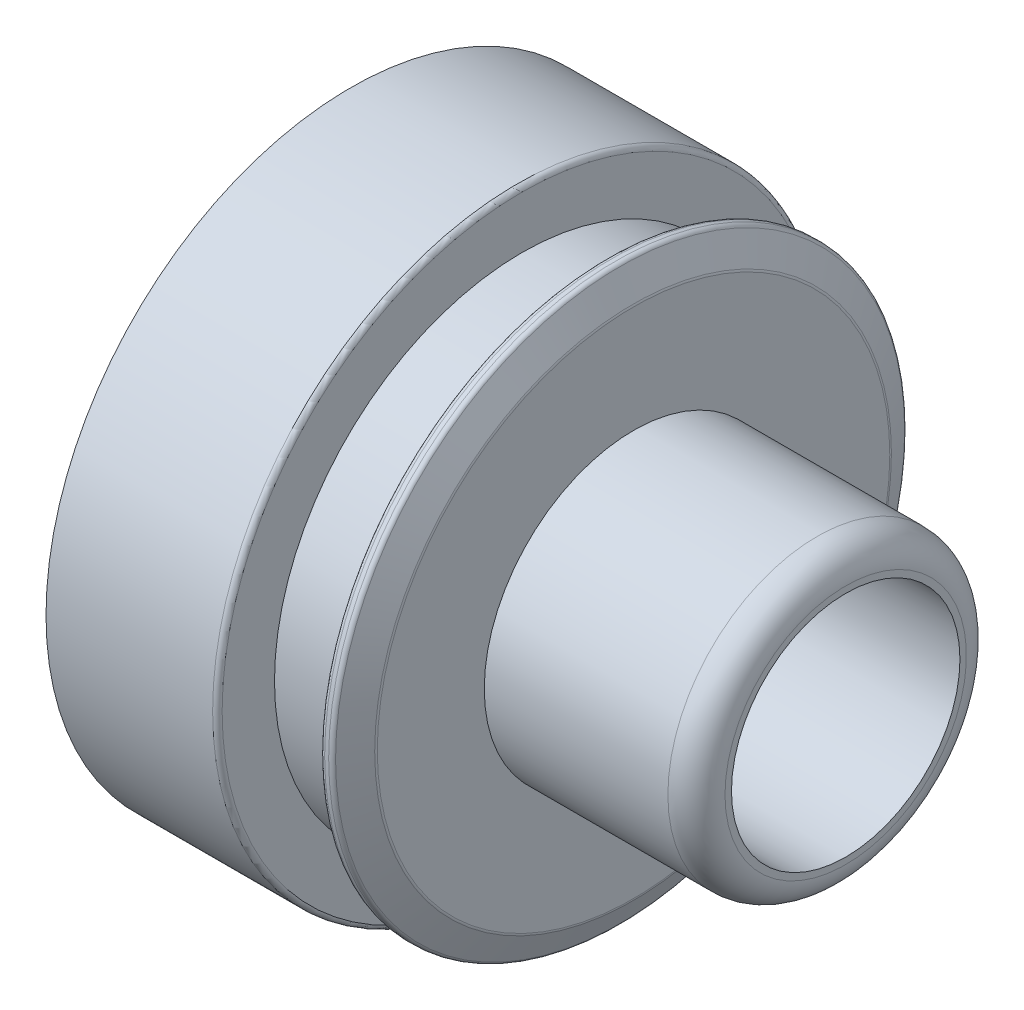
from build123d import *


with BuildPart() as part:
    # Croquis1 → Revolución1 (revolve)
    with BuildSketch(Plane(origin=(0, 0, 0), x_dir=(1, 0, 0), z_dir=(0, 1, 0)), mode=Mode.PRIVATE) as revoluci_n1_sk:
        with BuildLine():
            Line((0, 5), (1.25, 5))
            ThreePointArc((1.25, 5), (1.426776695, 4.926776695), (1.5, 4.75))
            Line((1.5, 4.75), (1.5, 4))
            Line((1.5, 4), (14.5, 4))
            Line((14.5, 4), (14.5, 6))
            Line((14.5, 6), (26.5, 6))
            Line((26.5, 6), (26.5, 6.34))
            ThreePointArc((26.5, 6.34), (26.060660172, 7.400660172), (25, 7.84))
            Line((25, 7.84), (15.357003491, 7.84))
            Line((15.357003491, 7.84), (15.357003491, 13.458407461))
            ThreePointArc((15.357003491, 13.458407461), (15.350449732, 13.515275093), (15.33113207, 13.569161151))
            Line((15.33113207, 13.569161151), (14.651666679, 14.944172781))
            ThreePointArc((14.651666679, 14.944172781), (14.5594691, 15.045773067), (14.4275381, 15.08341909))
            Line((14.4275381, 15.08341909), (14.216248796, 15.08341909))
            ThreePointArc((14.216248796, 15.08341909), (14.039472101, 15.010195786), (13.966248796, 14.83341909))
            Line((13.966248796, 14.83341909), (13.966248796, 13.000280659))
            Line((13.966248796, 13.000280659), (9.5, 13.000280659))
            Line((9.5, 13.000280659), (9.5, 15.75))
            ThreePointArc((9.5, 15.75), (9.426776695, 15.926776695), (9.25, 16))
            Line((9.25, 16), (0.5, 16))
            Line((0.5, 16), (0.5, 15.15))
            Line((0.5, 15.15), (1.554583004, 15.15))
            Line((1.554583004, 15.15), (1.554583004, 10.66))
            ThreePointArc((1.554583004, 10.66), (1.481359699, 10.483223305), (1.304583004, 10.41))
            Line((1.304583004, 10.41), (0, 10.41))
            Line((0, 10.41), (0, 8.272613208))
            Line((0, 8.272613208), (1.554583004, 8.272613208))
            Line((1.554583004, 8.272613208), (1.554583004, 7.012823374))
            Line((1.554583004, 7.012823374), (0, 7.012823374))
            Line((0, 7.012823374), (0, 5))
        make_face()
    revolve(revoluci_n1_sk.sketch.rotate(Axis((0, 0, 0), (1, 0, 0)), 180), axis=Axis((0, 0, 0), (1, 0, 0)))


solid = part.part
